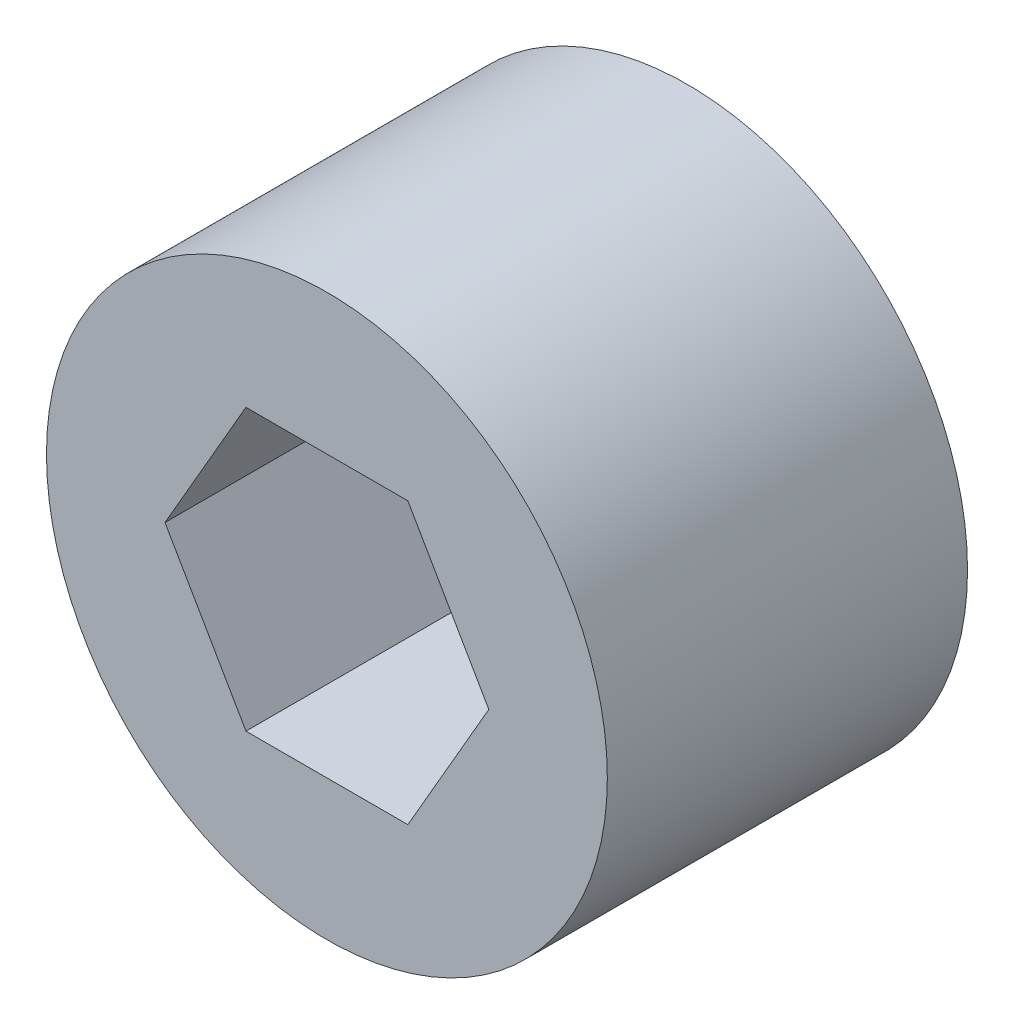
from build123d import *

# Parameters (mm, degrees)
SKETCH1_R           = 12.7
BOSS_EXTRUDE1_DEPTH = 8.15594


with BuildPart() as part:
    # Sketch1 → Boss-Extrude1 (new, symmetric)
    with BuildSketch(Plane.XY):
        Circle(SKETCH1_R)
        Polygon((-7.332348419, 0), (-3.666174209, -6.35), (3.666174209, -6.35), (7.332348419, 0), (3.666174209, 6.35), (-3.666174209, 6.35), align=None, mode=Mode.SUBTRACT)
    extrude(amount=BOSS_EXTRUDE1_DEPTH, both=True)


solid = part.part
